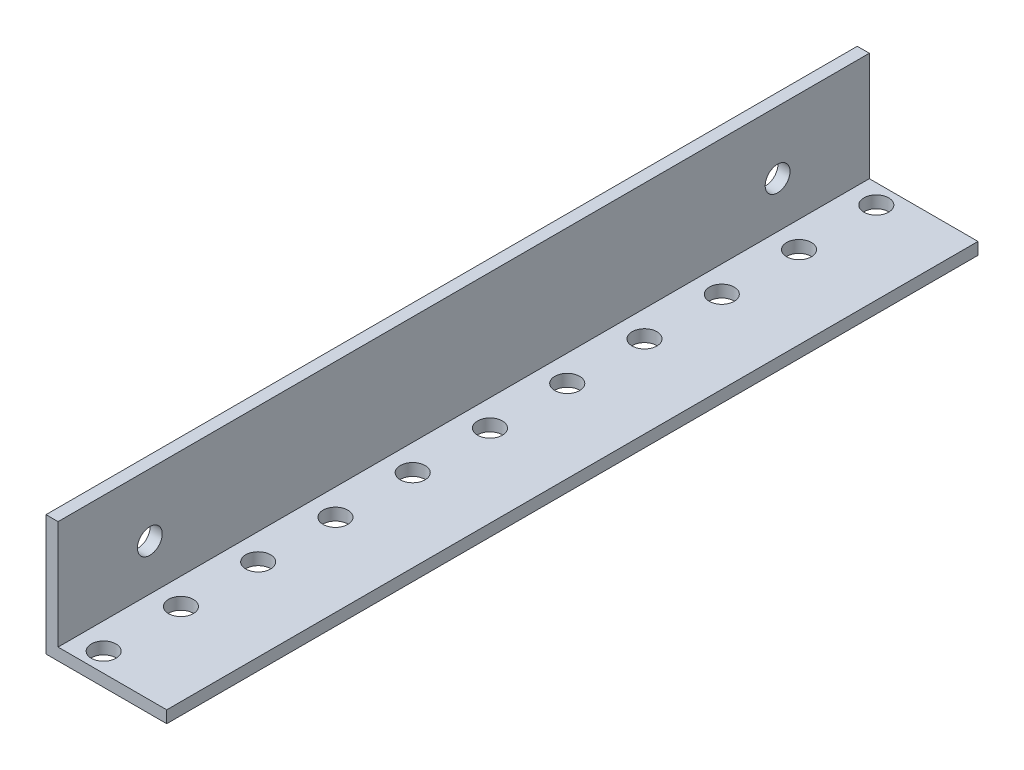
from build123d import *

# Parameters (mm, degrees)
EXTRUDE1_DEPTH            = 53.34
LPATTERN1_COUNT           = 6
LPATTERN1_PITCH           = 10.16
LPATTERN1_COL_COUNT       = 6
LPATTERN1_COL_PITCH       = 10.16
F_4_CLEARANCE_HOLE2_D     = 3.2639
F_4_CLEARANCE_HOLE2_DEPTH = 15.24
F_4_CLEARANCE_HOLE2_TIP   = 0.980574487


with BuildPart() as part:
    # Sketch1 → Extrude1 (new, symmetric)
    with BuildSketch(Plane.XY):
        Polygon((0, 0), (0, 15.875), (1.5875, 15.875), (1.5875, 1.5875), (15.875, 1.5875), (15.875, 0), align=None)
    extrude(amount=EXTRUDE1_DEPTH, both=True)

    # Sketch3 → #4 Clearance Hole1 (revolve, cut)
    with BuildSketch(Plane(origin=(5.0419, 1.5875, 0), x_dir=(0, 0, 1), z_dir=(1, 0, 0))):
        Polygon((0, 0), (0, 16.220574487), (1.63195, 15.24), (1.63195, 0), align=None)
    f_4_clearance_hole1 = revolve(axis=Axis((5.0419, 7.9375, 0), (0, -1, 0)), mode=Mode.SUBTRACT)

    # LPattern1: #4 Clearance Hole1 ×6
    with Locations(*[(0, 0, i * LPATTERN1_PITCH) for i in range(1, LPATTERN1_COUNT)]):
        add(f_4_clearance_hole1, mode=Mode.SUBTRACT)

    # LPattern1 col: #4 Clearance Hole1 ×6
    with Locations(*[(0, 0, -i * LPATTERN1_COL_PITCH) for i in range(1, LPATTERN1_COL_COUNT)]):
        add(f_4_clearance_hole1, mode=Mode.SUBTRACT)

    # #4 Clearance Hole2
    with Locations(Plane(origin=(1.5875, 7.64032, -41.275), x_dir=(0, 1, 0), z_dir=(1, 0, 0))):
        with Locations((0, 0), (0, 82.55)):
            Hole(F_4_CLEARANCE_HOLE2_D / 2, depth=F_4_CLEARANCE_HOLE2_DEPTH)
            with Locations((0, 0, -(F_4_CLEARANCE_HOLE2_DEPTH + F_4_CLEARANCE_HOLE2_TIP / 2))):  # 118° drill point
                Cone(0, F_4_CLEARANCE_HOLE2_D / 2, F_4_CLEARANCE_HOLE2_TIP, mode=Mode.SUBTRACT)


solid = part.part
